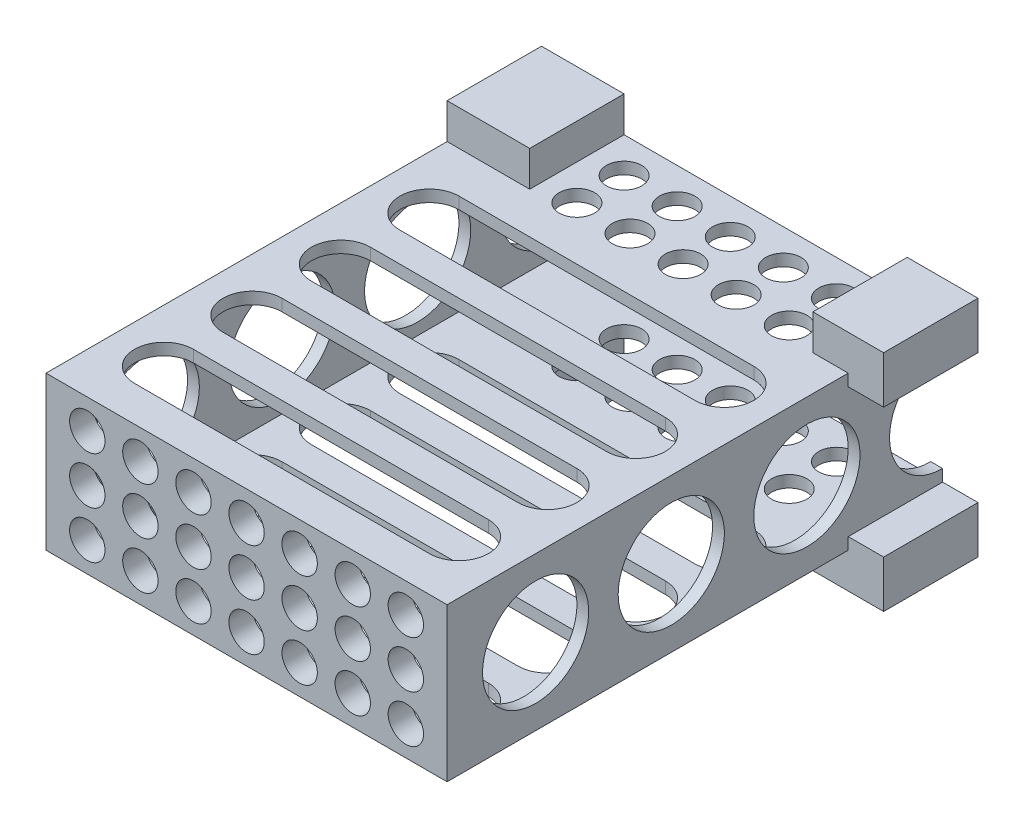
from build123d import *

# Parameters (mm, degrees)
SKICA1_W                 = 68
SKICA1_H                 = 26
P_IDAT_VYSUNUT_M1_DEPTH  = 4
SKICA2_W                 = 68
SKICA2_H                 = 26
SKICA2_W_2               = 64
SKICA2_H_2               = 22
P_IDAT_VYSUNUT_M2_DEPTH  = 80
P_IDAT_VYSUNUT_M9_DEPTH  = 16
SKICA3_R                 = 2
ODEBRAT_VYSUNUT_M1_DEPTH = 15
ODEBRAT_VYSUNUT_M2_DEPTH = 95.994736696
SKICA5_R                 = 9
ODEBRAT_VYSUNUT_M3_DEPTH = 111.620974503
SKICA8_W                 = 48
SKICA8_H                 = 6
ODEBRAT_VYSUNUT_M4_DEPTH = 16
SKICA9_R                 = 3
ODEBRAT_VYSUNUT_M5_DEPTH = 4
SKICA10_R                = 3
ODEBRAT_VYSUNUT_M6_DEPTH = 95.994736696


with BuildPart() as part:
    # Skica1 → Přidat vysunutím1 (new body)
    with BuildSketch(Plane.XY):
        Rectangle(SKICA1_W, SKICA1_H)
    extrude(amount=P_IDAT_VYSUNUT_M1_DEPTH)

    # Skica2 → Přidat vysunutím2 (add)
    with BuildSketch(Plane(origin=(0, 0, 0), x_dir=(-1, 0, 0), z_dir=(0, 0, -1))):
        Rectangle(SKICA2_W, SKICA2_H)
        Rectangle(SKICA2_W_2, SKICA2_H_2, mode=Mode.SUBTRACT)
    extrude(amount=P_IDAT_VYSUNUT_M2_DEPTH)

    # Skica7 → Přidat vysunutím9 (add)
    with BuildSketch(Plane.XY.offset(-80)):
        Polygon((3, 19), (40, 19), (40, 11), (34, 11), (34, 13), (-34, 13), (-34, 19), align=None)
        Polygon((-34, -19), (-34, -13), (34, -13), (34, -11), (40, -11), (40, -19), (3, -19), align=None)
    extrude(amount=P_IDAT_VYSUNUT_M9_DEPTH)

    # Skica3 → Odebrat vysunutím1 (cut)
    with BuildSketch(Plane(origin=(0, 0, -80), x_dir=(-1, 0, 0), z_dir=(0, 0, -1))):
        with Locations((-36, 15)):
            Circle(SKICA3_R)
        with Locations(Location((28, 15, 0), (0, 0, 180))):
            Circle(SKICA3_R)
        with Locations((28, -15)):
            Circle(SKICA3_R)
        with Locations(Location((-36, -15, 0), (0, 0, 180))):
            Circle(SKICA3_R)
    extrude(amount=-ODEBRAT_VYSUNUT_M1_DEPTH, mode=Mode.SUBTRACT)

    # Skica4 → Odebrat vysunutím2 (cut, through all)
    with BuildSketch(Plane.XZ.offset(13)):
        with BuildLine():
            Line((-25, -57), (25, -57))
            ThreePointArc((25, -57), (30, -52), (25, -47))
            Line((25, -47), (-25, -47))
            ThreePointArc((-25, -47), (-30, -52), (-25, -57))
        make_face()
        with BuildLine():
            Line((-25, -32), (25, -32))
            ThreePointArc((25, -32), (30, -37), (25, -42))
            Line((25, -42), (-25, -42))
            ThreePointArc((-25, -42), (-30, -37), (-25, -32))
        make_face()
        with BuildLine():
            Line((-25, -17), (25, -17))
            ThreePointArc((25, -17), (30, -22), (25, -27))
            Line((25, -27), (-25, -27))
            ThreePointArc((-25, -27), (-30, -22), (-25, -17))
        make_face()
        with BuildLine():
            Line((-25, -2), (25, -2))
            ThreePointArc((25, -2), (30, -7), (25, -12))
            Line((25, -12), (-25, -12))
            ThreePointArc((-25, -12), (-30, -7), (-25, -2))
        make_face()
    extrude(amount=-ODEBRAT_VYSUNUT_M2_DEPTH, mode=Mode.SUBTRACT)

    # Skica5 → Odebrat vysunutím3 (cut, through all)
    with BuildSketch(Plane.ZY.offset(34)):
        with Locations((-80, 0)):
            Circle(SKICA5_R)
        with Locations((-57, 0)):
            Circle(SKICA5_R)
        with Locations((-34, 0)):
            Circle(SKICA5_R)
        with Locations((-11, 0)):
            Circle(SKICA5_R)
    extrude(amount=-ODEBRAT_VYSUNUT_M3_DEPTH, mode=Mode.SUBTRACT)

    # Skica8 → Odebrat vysunutím4 (cut)
    with BuildSketch(Plane(origin=(0, 0, -80), x_dir=(-1, 0, 0), z_dir=(0, 0, -1))):
        with Locations((-4, 16)):
            Rectangle(SKICA8_W, SKICA8_H)
        with Locations((-4, -16)):
            Rectangle(SKICA8_W, SKICA8_H)
    extrude(amount=-ODEBRAT_VYSUNUT_M4_DEPTH, mode=Mode.SUBTRACT)

    # Skica9 → Odebrat vysunutím5 (cut)
    with BuildSketch(Plane.XY.offset(4)):
        with Locations((-27, 8)):
            Circle(SKICA9_R)
        with Locations((-18, 8)):
            Circle(SKICA9_R)
        with Locations((-9, 8)):
            Circle(SKICA9_R)
        with Locations((0, 8)):
            Circle(SKICA9_R)
        with Locations((9, 8)):
            Circle(SKICA9_R)
        with Locations((18, 8)):
            Circle(SKICA9_R)
        with Locations((27, 8)):
            Circle(SKICA9_R)
        with Locations((-18, 0)):
            Circle(SKICA9_R)
        with Locations((-9, 0)):
            Circle(SKICA9_R)
        Circle(SKICA9_R)
        with Locations((9, 0)):
            Circle(SKICA9_R)
        with Locations((18, 0)):
            Circle(SKICA9_R)
        with Locations((27, 0)):
            Circle(SKICA9_R)
        with Locations((-18, -8)):
            Circle(SKICA9_R)
        with Locations((-9, -8)):
            Circle(SKICA9_R)
        with Locations((0, -8)):
            Circle(SKICA9_R)
        with Locations((9, -8)):
            Circle(SKICA9_R)
        with Locations((18, -8)):
            Circle(SKICA9_R)
        with Locations((27, -8)):
            Circle(SKICA9_R)
        with Locations((-27, 0)):
            Circle(SKICA9_R)
        with Locations((-27, -8)):
            Circle(SKICA9_R)
    extrude(amount=-ODEBRAT_VYSUNUT_M5_DEPTH, mode=Mode.SUBTRACT)

    # Skica10 → Odebrat vysunutím6 (cut, through all)
    with BuildSketch(Plane(origin=(0, 13, 0), x_dir=(1, 0, 0), z_dir=(0, 1, 0))):
        with Locations(Location((-14, 74, 0), (0, 0, 270))):
            Circle(SKICA10_R)
        with Locations(Location((-5, 74, 0), (0, 0, 270))):
            Circle(SKICA10_R)
        with Locations(Location((4, 74, 0), (0, 0, 270))):
            Circle(SKICA10_R)
        with Locations(Location((13, 74, 0), (0, 0, 270))):
            Circle(SKICA10_R)
        with Locations(Location((22, 74, 0), (0, 0, 270))):
            Circle(SKICA10_R)
        with Locations(Location((-5, 66, 0), (0, 0, 270))):
            Circle(SKICA10_R)
        with Locations(Location((4, 66, 0), (0, 0, 270))):
            Circle(SKICA10_R)
        with Locations(Location((13, 66, 0), (0, 0, 270))):
            Circle(SKICA10_R)
        with Locations(Location((22, 66, 0), (0, 0, 270))):
            Circle(SKICA10_R)
        with Locations(Location((-14, 66, 0), (0, 0, 270))):
            Circle(SKICA10_R)
    extrude(amount=-ODEBRAT_VYSUNUT_M6_DEPTH, mode=Mode.SUBTRACT)


solid = part.part
